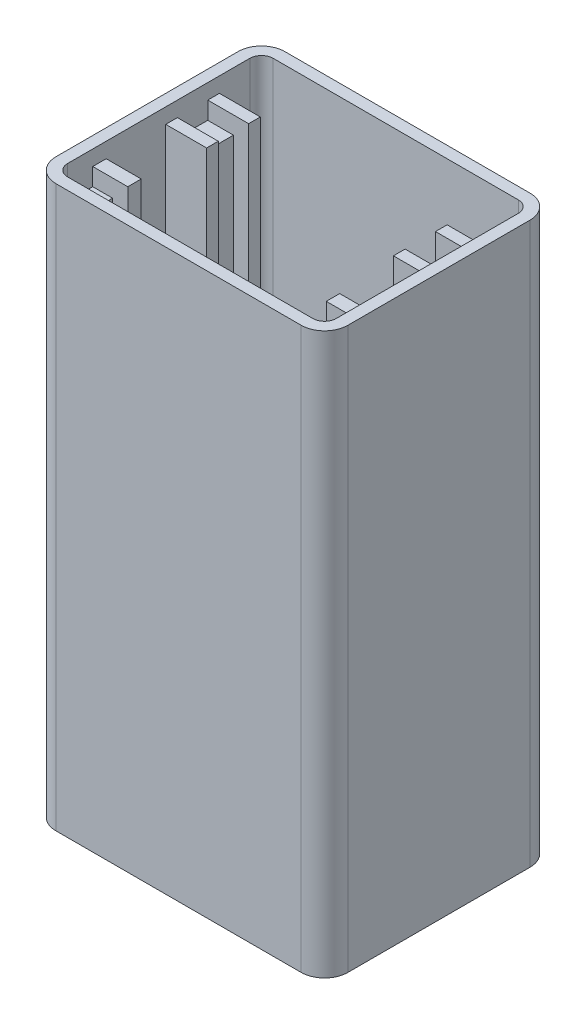
from build123d import *

# Parameters (mm, degrees)
SKETCH_1_R          = 2.9
EXTRUDE_3_DEPTH     = 1
EXTRUDE_6_DEPTH     = 47
CUT_EXTRUDE_START   = -1.3
CUT_EXTRUDE_1_DEPTH = 1.3
CUT_EXTRUDE_START_2 = -1.5
SKETCH_6_W          = 2.2
SKETCH_6_H          = 2.6
CUT_EXTRUDE_2_DEPTH = 1.5


with BuildPart() as part:
    # Эскиз1 → Бобышка-Вытянуть3 (new body)
    with BuildSketch(Plane(origin=(0, 0, 0), x_dir=(1, 0, 0), z_dir=(0, 1, 0))):
        with BuildLine():
            Line((-11.72321672, 11.668784432), (-11.72321672, 27.268784432))
            ThreePointArc((-11.72321672, 27.268784432), (-11.137430283, 28.682997994), (-9.72321672, 29.268784432))
            Line((-9.72321672, 29.268784432), (11.27678328, 29.268784432))
            ThreePointArc((11.27678328, 29.268784432), (12.690996842, 28.682997994), (13.27678328, 27.268784432))
            Line((13.27678328, 27.268784432), (13.27678328, 11.668784432))
            ThreePointArc((13.27678328, 11.668784432), (12.690996842, 10.254570869), (11.27678328, 9.668784432))
            Line((11.27678328, 9.668784432), (9.27678328, 9.668784432))
            Line((9.27678328, 9.668784432), (-9.72321672, 9.668784432))
            ThreePointArc((-9.72321672, 9.668784432), (-11.137430283, 10.254570869), (-11.72321672, 11.668784432))
        make_face()
        with Locations(Location((5.02678328, 15.968784432, 0), (0, 0, 270))):
            Circle(SKETCH_1_R, mode=Mode.SUBTRACT)
        with BuildLine():
            Line((-1.45321672, 26.968784432), (5.00678328, 26.968784432))
            ThreePointArc((5.00678328, 26.968784432), (6.187651604, 26.479652756), (6.67678328, 25.298784432))
            Line((6.67678328, 25.298784432), (6.67678328, 24.638784432))
            ThreePointArc((6.67678328, 24.638784432), (6.187651604, 23.457916107), (5.00678328, 22.968784432))
            Line((5.00678328, 22.968784432), (-1.45321672, 22.968784432))
            ThreePointArc((-1.45321672, 22.968784432), (-2.634085045, 23.457916107), (-3.12321672, 24.638784432))
            Line((-3.12321672, 24.638784432), (-3.12321672, 25.298784432))
            ThreePointArc((-3.12321672, 25.298784432), (-2.634085045, 26.479652756), (-1.45321672, 26.968784432))
        make_face(mode=Mode.SUBTRACT)
    extrude(amount=EXTRUDE_3_DEPTH)

    # Эскиз3 → Бобышка-Вытянуть6 (add)
    with BuildSketch(Plane(origin=(0, 1, 0), x_dir=(1, 0, 0), z_dir=(0, 1, 0))):
        with BuildLine():
            Line((-11.72321672, 27.268784432), (-11.72321672, 11.668784432))
            ThreePointArc((-11.72321672, 11.668784432), (-11.137430283, 10.254570869), (-9.72321672, 9.668784432))
            Line((-9.72321672, 9.668784432), (11.27678328, 9.668784432))
            ThreePointArc((11.27678328, 9.668784432), (12.690996842, 10.254570869), (13.27678328, 11.668784432))
            Line((13.27678328, 11.668784432), (13.27678328, 27.268784432))
            ThreePointArc((13.27678328, 27.268784432), (12.690996842, 28.682997994), (11.27678328, 29.268784432))
            Line((11.27678328, 29.268784432), (-9.72321672, 29.268784432))
            ThreePointArc((-9.72321672, 29.268784432), (-11.137430283, 28.682997994), (-11.72321672, 27.268784432))
        make_face()
        with BuildLine():
            Line((12.27678328, 14.968784432), (9.27678328, 14.968784432))
            Line((9.27678328, 14.968784432), (9.27678328, 13.818784432))
            Line((9.27678328, 13.818784432), (10.57678328, 13.818784432))
            Line((10.57678328, 13.818784432), (10.57678328, 11.318784432))
            Line((10.57678328, 11.318784432), (9.27678328, 11.318784432))
            Line((9.27678328, 11.318784432), (9.27678328, 10.668784432))
            Line((9.27678328, 10.668784432), (-7.72321672, 10.668784432))
            Line((-7.72321672, 10.668784432), (-7.72321672, 11.318784432))
            Line((-7.72321672, 11.318784432), (-9.02321672, 11.318784432))
            Line((-9.02321672, 11.318784432), (-9.02321672, 13.818784432))
            Line((-9.02321672, 13.818784432), (-7.72321672, 13.818784432))
            Line((-7.72321672, 13.818784432), (-7.72321672, 14.968784432))
            Line((-7.72321672, 14.968784432), (-10.72321672, 14.968784432))
            Line((-10.72321672, 14.968784432), (-10.72321672, 20.068784432))
            Line((-10.72321672, 20.068784432), (-7.22321672, 20.068784432))
            Line((-7.22321672, 20.068784432), (-7.22321672, 21.068784432))
            Line((-7.22321672, 21.068784432), (-8.52321672, 21.068784432))
            Line((-8.52321672, 21.068784432), (-8.52321672, 23.668784432))
            Line((-8.52321672, 23.668784432), (-7.22321672, 23.668784432))
            Line((-7.22321672, 23.668784432), (-7.22321672, 24.668784432))
            Line((-7.22321672, 24.668784432), (-10.72321672, 24.668784432))
            Line((-10.72321672, 24.668784432), (-10.72321672, 27.268784432))
            ThreePointArc((-10.72321672, 27.268784432), (-10.430323502, 27.975891213), (-9.72321672, 28.268784432))
            Line((-9.72321672, 28.268784432), (11.27678328, 28.268784432))
            ThreePointArc((11.27678328, 28.268784432), (11.983890061, 27.975891213), (12.27678328, 27.268784432))
            Line((12.27678328, 27.268784432), (12.27678328, 24.668784432))
            Line((12.27678328, 24.668784432), (8.77678328, 24.668784432))
            Line((8.77678328, 24.668784432), (8.77678328, 23.668784432))
            Line((8.77678328, 23.668784432), (10.07678328, 23.668784432))
            Line((10.07678328, 23.668784432), (10.07678328, 21.068784432))
            Line((10.07678328, 21.068784432), (8.77678328, 21.068784432))
            Line((8.77678328, 21.068784432), (8.77678328, 20.068784432))
            Line((8.77678328, 20.068784432), (12.27678328, 20.068784432))
            Line((12.27678328, 20.068784432), (12.27678328, 14.968784432))
        make_face(mode=Mode.SUBTRACT)
    extrude(amount=EXTRUDE_6_DEPTH)

    # Эскиз5 → Вырез-Вытянуть1 (cut)
    with BuildSketch(Plane(origin=(0, 48, 0), x_dir=(1, 0, 0), z_dir=(0, 1, 0)).offset(CUT_EXTRUDE_START)):
        with BuildLine():
            Line((-9.72321672, 28.268784432), (11.27678328, 28.268784432))
            ThreePointArc((11.27678328, 28.268784432), (11.983890061, 27.975891213), (12.27678328, 27.268784432))
            Line((12.27678328, 27.268784432), (12.27678328, 11.668784432))
            ThreePointArc((12.27678328, 11.668784432), (11.983890061, 10.961677651), (11.27678328, 10.668784432))
            Line((11.27678328, 10.668784432), (-9.72321672, 10.668784432))
            ThreePointArc((-9.72321672, 10.668784432), (-10.430323502, 10.961677651), (-10.72321672, 11.668784432))
            Line((-10.72321672, 11.668784432), (-10.72321672, 27.268784432))
            ThreePointArc((-10.72321672, 27.268784432), (-10.430323502, 27.975891213), (-9.72321672, 28.268784432))
        make_face()
    extrude(amount=CUT_EXTRUDE_1_DEPTH, mode=Mode.SUBTRACT)

    # Эскиз6 → Вырез-Вытянуть2 (cut)
    with BuildSketch(Plane(origin=(0, 46.7, 0), x_dir=(1, 0, 0), z_dir=(0, 1, 0)).offset(CUT_EXTRUDE_START_2)):
        with Locations((-9.62321672, 22.368784432)):
            Rectangle(SKETCH_6_W, SKETCH_6_H)
        with Locations((11.17678328, 22.368784432)):
            Rectangle(SKETCH_6_W, SKETCH_6_H)
        with BuildLine():
            Line((10.57678328, 13.818784432), (10.57678328, 11.318784432))
            Line((10.57678328, 11.318784432), (12.213532979, 11.318784432))
            ThreePointArc((12.213532979, 11.318784432), (12.260843669, 11.490949817), (12.27678328, 11.668784432))
            Line((12.27678328, 11.668784432), (12.27678328, 13.818784432))
            Line((12.27678328, 13.818784432), (10.57678328, 13.818784432))
        make_face()
        with BuildLine():
            Line((-9.02321672, 13.818784432), (-10.72321672, 13.818784432))
            Line((-10.72321672, 13.818784432), (-10.72321672, 11.668784432))
            ThreePointArc((-10.72321672, 11.668784432), (-10.70727711, 11.490949817), (-10.65996642, 11.318784432))
            Line((-10.65996642, 11.318784432), (-9.02321672, 11.318784432))
            Line((-9.02321672, 11.318784432), (-9.02321672, 13.818784432))
        make_face()
    extrude(amount=CUT_EXTRUDE_2_DEPTH, mode=Mode.SUBTRACT)


solid = part.part
